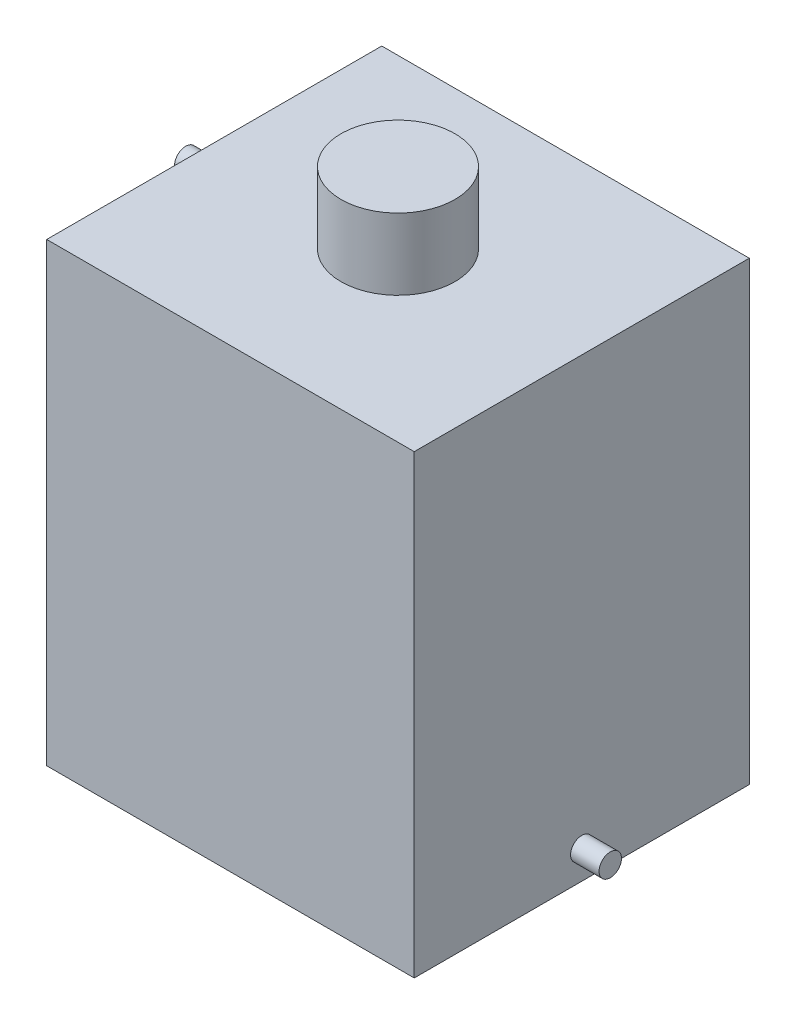
from build123d import *

# Parameters (mm, degrees)
SKETCH1_W           = 163.83
SKETCH1_H           = 149.352
BOSS_EXTRUDE1_DEPTH = 203.2
SKETCH2_R           = 25.4
BOSS_EXTRUDE2_DEPTH = 31.75
SKETCH3_R           = 5
BOSS_EXTRUDE3_DEPTH = 12.7
SKETCH5_R           = 5
BOSS_EXTRUDE4_DEPTH = 12.7


with BuildPart() as part:
    # Sketch1 → Boss-Extrude1 (new body)
    with BuildSketch(Plane(origin=(0, 0, 0), x_dir=(1, 0, 0), z_dir=(0, 1, 0))):
        Rectangle(SKETCH1_W, SKETCH1_H)
    extrude(amount=BOSS_EXTRUDE1_DEPTH)

    # Sketch2 → Boss-Extrude2 (add)
    with BuildSketch(Plane(origin=(0, 203.2, 0), x_dir=(1, 0, 0), z_dir=(0, 1, 0))):
        with Locations(Location((0, 0, 0), (0, 0, 270))):
            Circle(SKETCH2_R)
    extrude(amount=BOSS_EXTRUDE2_DEPTH)

    # Sketch3 → Boss-Extrude3 (add)
    with BuildSketch(Plane.ZY.offset(81.915)):
        with Locations(Location((0, 190.5, 0), (0, 0, 180))):
            Circle(SKETCH3_R)
    extrude(amount=BOSS_EXTRUDE3_DEPTH)

    # Sketch5 → Boss-Extrude4 (add)
    with BuildSketch(Plane(origin=(81.915, 0, 0), x_dir=(0, 0, -1), z_dir=(1, 0, 0))):
        with Locations(Location((0, 12.7, 0), (0, 0, 180))):
            Circle(SKETCH5_R)
    extrude(amount=BOSS_EXTRUDE4_DEPTH)


solid = part.part
